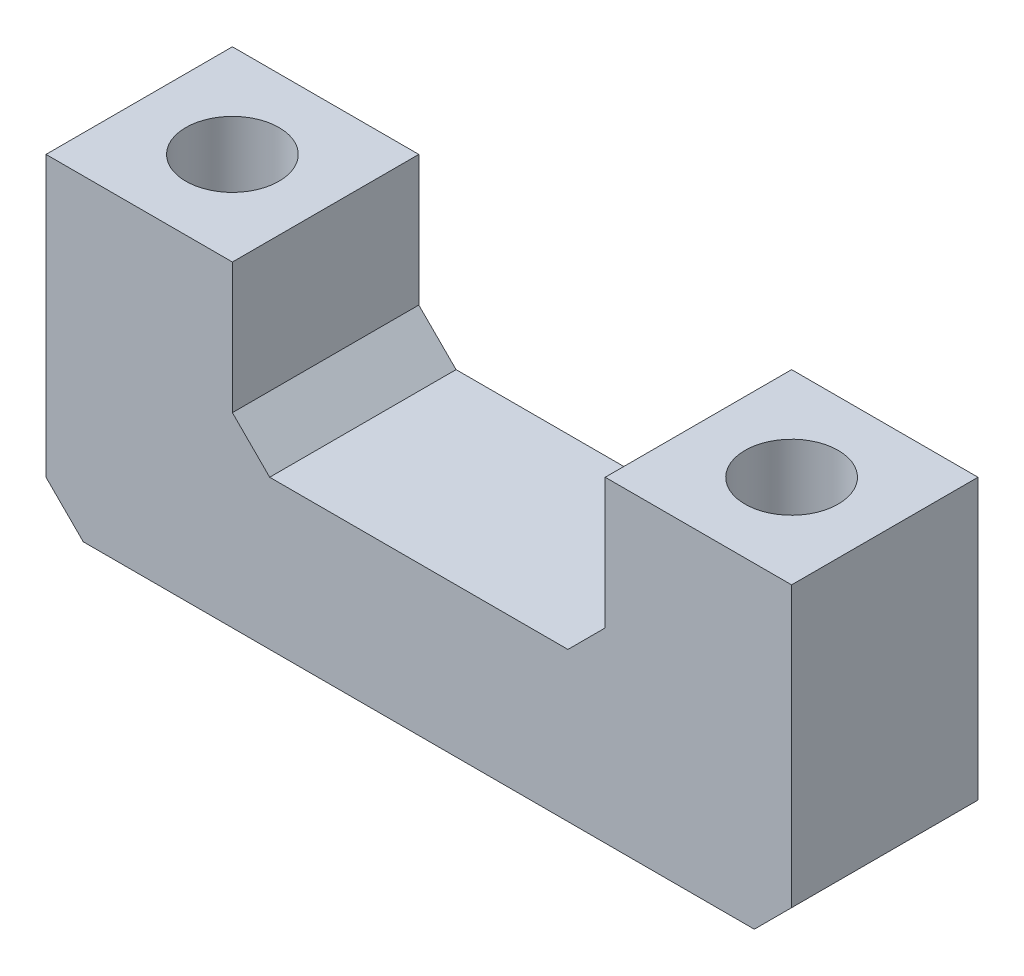
from build123d import *

# Parameters (mm, degrees)
EXTRUDE_1_DEPTH    = 2.5
HOLE_WIZARD_M3_1_D = 2.5
CHAMFER_1_SIZE     = 1


with BuildPart() as part:
    # 草图1 → 凸台-拉伸1 (new, symmetric)
    with BuildSketch(Plane.XY):
        Polygon((-5, -4.5), (5, -4.5), (5, 0), (10, 0), (10, -8.5), (-10, -8.5), (-10, 0), (-5, 0), align=None)
    extrude(amount=EXTRUDE_1_DEPTH, both=True)

    # M3 螺纹孔1 (through all)
    with Locations(Plane(origin=(0, -8.5, 0), x_dir=(-1, 0, 0), z_dir=(0, -1, 0))):
        with Locations((7.5, 0), (-7.5, 0)):
            Hole(HOLE_WIZARD_M3_1_D / 2)

    # 倒角1
    chamfer_1_edges = [part.edges().sort_by_distance(p)[0] for p in [
        (10, -8.5, 0),
        (-10, -8.5, 0),
        (-5, -4.5, 0),
        (5, -4.5, 0),
    ]]
    chamfer(chamfer_1_edges, length=CHAMFER_1_SIZE)


solid = part.part
